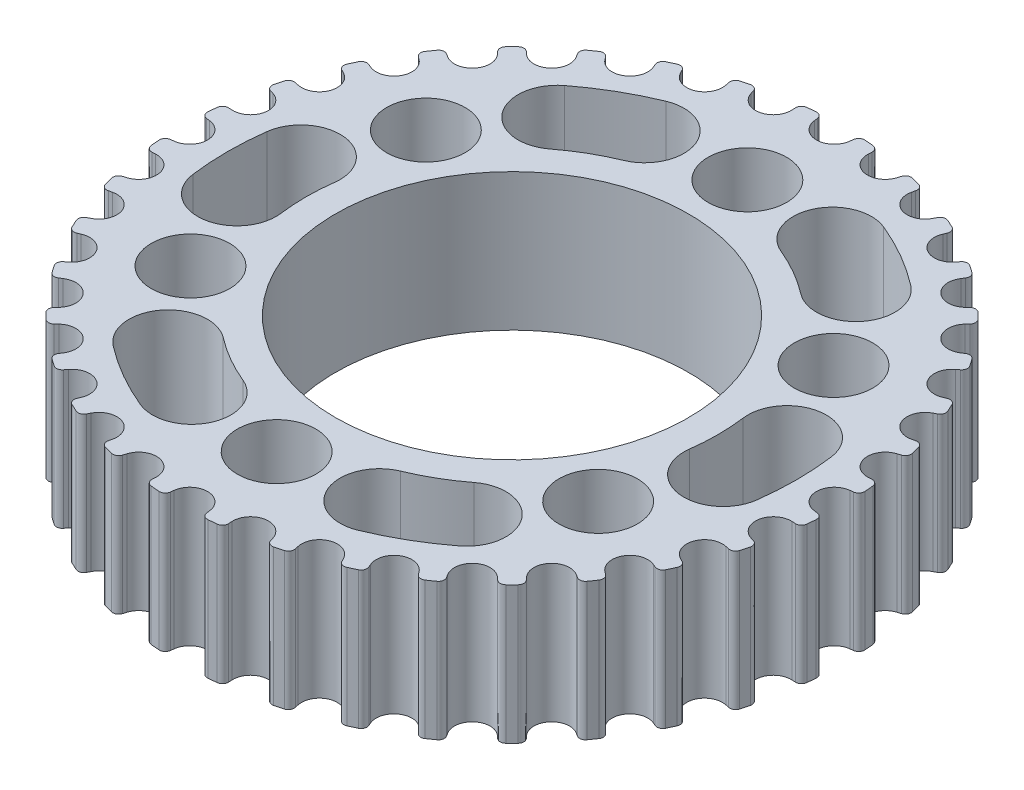
from build123d import *

# Parameters (mm, degrees)
SKETCH_1_R               = 16.8
EXTRUDE_1_DEPTH          = 3.5
CUT_EXTRUDE_1_DEPTH      = 50
PATTERN_CIRCULAR_1_COUNT = 36
SKETCH_4_R               = 9
CUT_EXTRUDE_2_DEPTH      = 50
SKETCH_5_R               = 2
CUT_EXTRUDE_4_DEPTH      = 25.70705312
CUT_EXTRUDE_5_DEPTH      = 10


with BuildPart() as part:
    # 草图1 → 凸台-拉伸1 (new, symmetric)
    with BuildSketch(Plane(origin=(0, 0, 0), x_dir=(1, 0, 0), z_dir=(0, 1, 0))):
        Circle(SKETCH_1_R)
    extrude(amount=EXTRUDE_1_DEPTH, both=True)

    # 草图2 → 切除-拉伸1 (cut, symmetric)
    with BuildSketch(Plane(origin=(0, 0, 0), x_dir=(1, 0, 0), z_dir=(0, 1, 0))):
        with BuildLine():
            Line((-0.903216998, 16.319098898), (-0.924353128, 16.491238864))
            ThreePointArc((-0.924353128, 16.491238864), (-1.031794245, 16.686577305), (-1.244337282, 16.753854026))
            ThreePointArc((-1.244337282, 16.753854026), (0, 16.8), (1.244337282, 16.753854026))
            ThreePointArc((1.244337282, 16.753854026), (1.031794245, 16.686577305), (0.924353128, 16.491238864))
            Line((0.924353128, 16.491238864), (0.903216998, 16.319098898))
            ThreePointArc((0.903216998, 16.319098898), (0, 15.52), (-0.903216998, 16.319098898))
        make_face()
    cut_extrude_1 = extrude(amount=CUT_EXTRUDE_1_DEPTH, both=True, mode=Mode.SUBTRACT)

    # 阵列(圆周)1: 切除-拉伸1 ×36 about axis
    pattern_circular_1_axis = Axis((0, -44, 0), (0, 1, 0))
    for i in range(1, PATTERN_CIRCULAR_1_COUNT):
        add(cut_extrude_1.rotate(pattern_circular_1_axis, i * 360 / PATTERN_CIRCULAR_1_COUNT), mode=Mode.SUBTRACT)

    # 草图4 → 切除-拉伸2 (cut, symmetric)
    with BuildSketch(Plane(origin=(0, 0, 0), x_dir=(1, 0, 0), z_dir=(0, 1, 0))):
        Circle(SKETCH_4_R)
    extrude(amount=CUT_EXTRUDE_2_DEPTH, both=True, mode=Mode.SUBTRACT)

    # 草图5 → 切除-拉伸4 (cut, through all)
    with BuildSketch(Plane(origin=(0, 3.5, 0), x_dir=(1, 0, 0), z_dir=(0, 1, 0))):
        with Locations((0, 12)):
            Circle(SKETCH_5_R)
        with Locations((10.392304845, 6)):
            Circle(SKETCH_5_R)
        with Locations((10.392304845, -6)):
            Circle(SKETCH_5_R)
        with Locations((0, -12)):
            Circle(SKETCH_5_R)
        with Locations((-10.392304845, -6)):
            Circle(SKETCH_5_R)
        with Locations((-10.392304845, 6)):
            Circle(SKETCH_5_R)
    extrude(amount=-CUT_EXTRUDE_4_DEPTH, mode=Mode.SUBTRACT)

    # 草图6 → 切除-拉伸5 (cut)
    with BuildSketch(Plane(origin=(0, 3.5, 0), x_dir=(1, 0, 0), z_dir=(0, 1, 0))):
        with BuildLine():
            ThreePointArc((8.827040721, 11.503623434), (7.25, 12.557368355), (5.548909769, 13.396253221))
            ThreePointArc((5.548909769, 13.396253221), (2.93578384, 12.313861021), (4.01817604, 9.700735091))
            ThreePointArc((4.01817604, 9.700735091), (5.25, 9.09326674), (6.391995005, 8.330210073))
            ThreePointArc((6.391995005, 8.330210073), (9.196224543, 8.699393896), (8.827040721, 11.503623434))
        make_face()
        with BuildLine():
            ThreePointArc((14.37595049, -1.892629787), (14.5, 0), (14.37595049, 1.892629787))
            ThreePointArc((14.37595049, 1.892629787), (12.132008383, 3.614467125), (10.410171044, 1.370525018))
            ThreePointArc((10.410171044, 1.370525018), (10.5, 0), (10.410171044, -1.370525018))
            ThreePointArc((10.410171044, -1.370525018), (12.132008383, -3.614467125), (14.37595049, -1.892629787))
        make_face()
        with BuildLine():
            ThreePointArc((5.548909769, -13.396253221), (7.25, -12.557368355), (8.827040721, -11.503623434))
            ThreePointArc((8.827040721, -11.503623434), (9.196224543, -8.699393896), (6.391995005, -8.330210073))
            ThreePointArc((6.391995005, -8.330210073), (5.25, -9.09326674), (4.01817604, -9.700735091))
            ThreePointArc((4.01817604, -9.700735091), (2.93578384, -12.313861021), (5.548909769, -13.396253221))
        make_face()
        with BuildLine():
            ThreePointArc((-8.827040721, -11.503623434), (-7.25, -12.557368355), (-5.548909769, -13.396253221))
            ThreePointArc((-5.548909769, -13.396253221), (-2.93578384, -12.313861021), (-4.01817604, -9.700735091))
            ThreePointArc((-4.01817604, -9.700735091), (-5.25, -9.09326674), (-6.391995005, -8.330210073))
            ThreePointArc((-6.391995005, -8.330210073), (-9.196224543, -8.699393896), (-8.827040721, -11.503623434))
        make_face()
        with BuildLine():
            ThreePointArc((-14.37595049, 1.892629787), (-14.5, 0), (-14.37595049, -1.892629787))
            ThreePointArc((-14.37595049, -1.892629787), (-12.132008383, -3.614467125), (-10.410171044, -1.370525018))
            ThreePointArc((-10.410171044, -1.370525018), (-10.5, 0), (-10.410171044, 1.370525018))
            ThreePointArc((-10.410171044, 1.370525018), (-12.132008383, 3.614467125), (-14.37595049, 1.892629787))
        make_face()
        with BuildLine():
            ThreePointArc((-5.548909769, 13.396253221), (-7.25, 12.557368355), (-8.827040721, 11.503623434))
            ThreePointArc((-8.827040721, 11.503623434), (-9.196224543, 8.699393896), (-6.391995005, 8.330210073))
            ThreePointArc((-6.391995005, 8.330210073), (-5.25, 9.09326674), (-4.01817604, 9.700735091))
            ThreePointArc((-4.01817604, 9.700735091), (-2.93578384, 12.313861021), (-5.548909769, 13.396253221))
        make_face()
    extrude(amount=-CUT_EXTRUDE_5_DEPTH, mode=Mode.SUBTRACT)


solid = part.part
